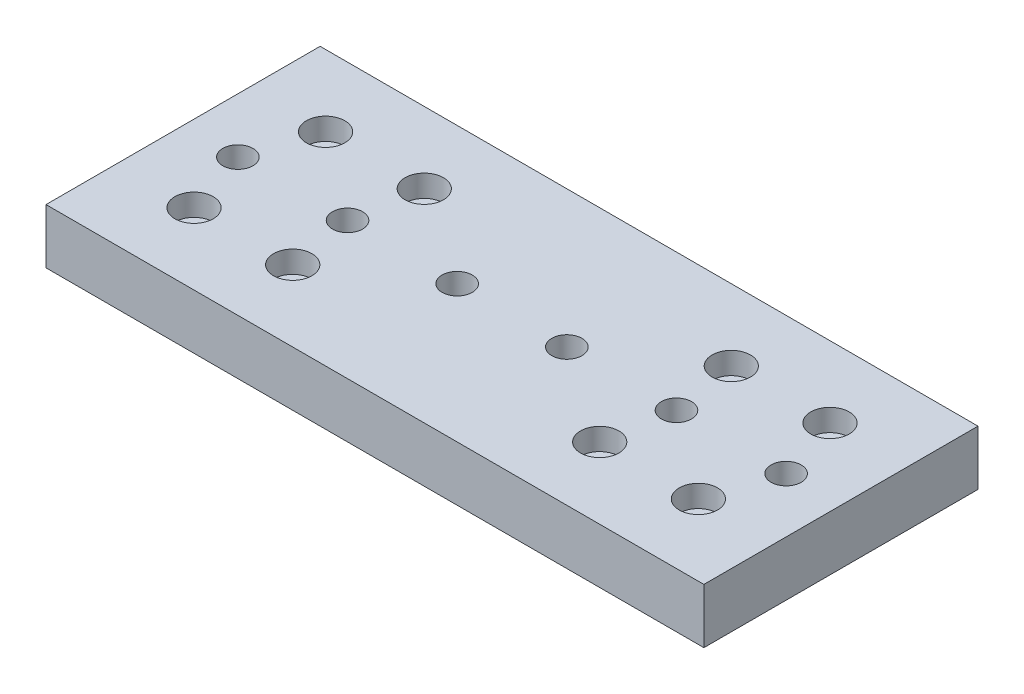
from build123d import *

# Parameters (mm, degrees)
SKETCH1_W                                            = 120
SKETCH1_H                                            = 50
MAIN_DEPTH                                           = 10
SKETCH2_R                                            = 1.5
LINEAR_BEARING_MOUNT_DEPTH                           = 66.76473219
SKETCH5_R                                            = 3.5
LINEAR_BEARING_COUNTERSINK_DEPTH                     = 4
SKETCH6_R                                            = 2.5
CUT_EXTRUDE1_DEPTH                                   = 66.76473219
CSK_FOR_M5_SOCKET_COUNTERSUNK_HEAD_SCREW_D           = 5.5
CSK_FOR_M5_SOCKET_COUNTERSUNK_HEAD_SCREW_DEPTH       = 10
CSK_FOR_M5_SOCKET_COUNTERSUNK_HEAD_SCREW_CSINK_D     = 11.47
CSK_FOR_M5_SOCKET_COUNTERSUNK_HEAD_SCREW_CSINK_ANGLE = 90
CSK_FOR_M5_SOCKET_COUNTERSUNK_HEAD_SCREW_TIP         = 1.652366702


with BuildPart() as part:
    # Sketch1 → main (new body)
    with BuildSketch(Plane(origin=(0, 0, 0), x_dir=(1, 0, 0), z_dir=(0, 1, 0))):
        Rectangle(SKETCH1_W, SKETCH1_H)
    extrude(amount=MAIN_DEPTH)

    # Sketch2 → linear_bearing_mount (cut, through all)
    with BuildSketch(Plane(origin=(0, 10, 0), x_dir=(1, 0, 0), z_dir=(0, 1, 0))):
        with Locations(Location((-28, -12, 0), (0, 0, 90))):
            Circle(SKETCH2_R)
        with Locations(Location((-46, -12, 0), (0, 0, 90))):
            Circle(SKETCH2_R)
        with Locations(Location((28, -12, 0), (0, 0, 270))):
            Circle(SKETCH2_R)
        with Locations(Location((46, -12, 0), (0, 0, 270))):
            Circle(SKETCH2_R)
        with Locations(Location((46, 12, 0), (0, 0, 90))):
            Circle(SKETCH2_R)
        with Locations(Location((28, 12, 0), (0, 0, 90))):
            Circle(SKETCH2_R)
        with Locations(Location((-46, 12, 0), (0, 0, 270))):
            Circle(SKETCH2_R)
        with Locations(Location((-28, 12, 0), (0, 0, 270))):
            Circle(SKETCH2_R)
    extrude(amount=-LINEAR_BEARING_MOUNT_DEPTH, mode=Mode.SUBTRACT)

    # Sketch5 → linear_bearing_countersink (cut)
    with BuildSketch(Plane(origin=(0, 10, 0), x_dir=(1, 0, 0), z_dir=(0, 1, 0))):
        with Locations(Location((-46, 12, 0), (0, 0, 270))):
            Circle(SKETCH5_R)
        with Locations(Location((-28, 12, 0), (0, 0, 270))):
            Circle(SKETCH5_R)
        with Locations(Location((-28, -12, 0), (0, 0, 90))):
            Circle(SKETCH5_R)
        with Locations(Location((-46, -12, 0), (0, 0, 90))):
            Circle(SKETCH5_R)
        with Locations(Location((46, -12, 0), (0, 0, 270))):
            Circle(SKETCH5_R)
        with Locations(Location((28, -12, 0), (0, 0, 270))):
            Circle(SKETCH5_R)
        with Locations(Location((28, 12, 0), (0, 0, 90))):
            Circle(SKETCH5_R)
        with Locations(Location((46, 12, 0), (0, 0, 90))):
            Circle(SKETCH5_R)
    extrude(amount=-LINEAR_BEARING_COUNTERSINK_DEPTH, mode=Mode.SUBTRACT)

    # Sketch6 → Cut-Extrude1 (cut, through all)
    with BuildSketch(Plane.XZ):
        with Locations(Location((-50, 0, 0), (0, 0, 270))):
            Circle(SKETCH6_R)
        with Locations(Location((-30, 0, 0), (0, 0, 270))):
            Circle(SKETCH6_R)
        with Locations(Location((-10, 0, 0), (0, 0, 270))):
            Circle(SKETCH6_R)
        with Locations(Location((10, 0, 0), (0, 0, 270))):
            Circle(SKETCH6_R)
        with Locations(Location((30, 0, 0), (0, 0, 270))):
            Circle(SKETCH6_R)
        with Locations(Location((50, 0, 0), (0, 0, 270))):
            Circle(SKETCH6_R)
    extrude(amount=-CUT_EXTRUDE1_DEPTH, mode=Mode.SUBTRACT)

    # CSK for M5 socket countersunk head screw1
    with Locations(Plane(origin=(0, 0, 0), x_dir=(-1, 0, 0), z_dir=(0, -1, 0))):
        with Locations((-50, 0), (-30, 0), (-10, 0), (10, 0), (30, 0), (50, 0)):
            CounterSinkHole(CSK_FOR_M5_SOCKET_COUNTERSUNK_HEAD_SCREW_D / 2, CSK_FOR_M5_SOCKET_COUNTERSUNK_HEAD_SCREW_CSINK_D / 2, depth=CSK_FOR_M5_SOCKET_COUNTERSUNK_HEAD_SCREW_DEPTH, counter_sink_angle=CSK_FOR_M5_SOCKET_COUNTERSUNK_HEAD_SCREW_CSINK_ANGLE)
            with Locations((0, 0, -(CSK_FOR_M5_SOCKET_COUNTERSUNK_HEAD_SCREW_DEPTH + CSK_FOR_M5_SOCKET_COUNTERSUNK_HEAD_SCREW_TIP / 2))):  # 118° drill point
                Cone(0, CSK_FOR_M5_SOCKET_COUNTERSUNK_HEAD_SCREW_D / 2, CSK_FOR_M5_SOCKET_COUNTERSUNK_HEAD_SCREW_TIP, mode=Mode.SUBTRACT)


solid = part.part
